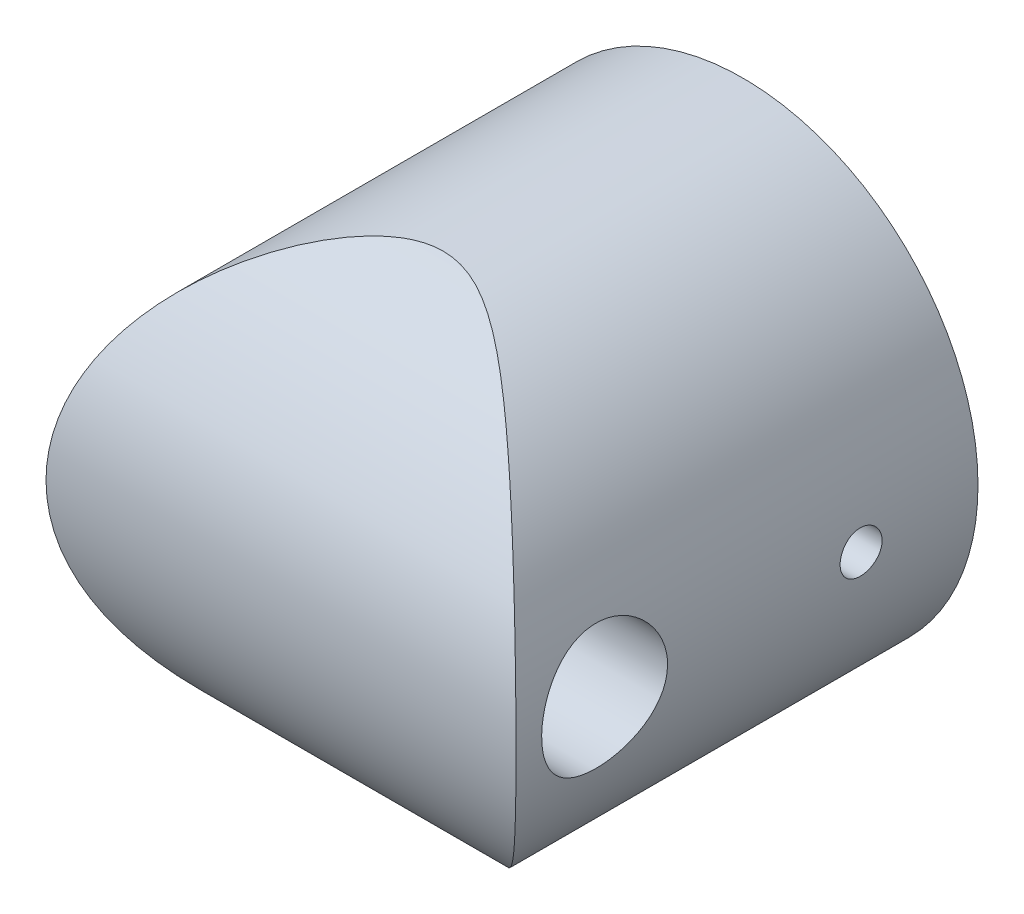
from build123d import *

# Parameters (mm, degrees)
SKETCH1_R                = 19.6
SKETCH1_R_2              = 16.6
BOSS_EXTRUDE1_DEPTH      = 20
SKETCH2_R                = 19.6
BOSS_EXTRUDE2_DEPTH      = 5
BOSS_EXTRUDE4_DEPTH      = 25
BOSS_EXTRUDE4_DEPTH_BACK = 25
SKETCH3_R                = 5.25
SKETCH4_R                = 39.6
SKETCH4_R_2              = 19.6
CUT_EXTRUDE_THIN1_DEPTH  = 25
CUT_EXTRUDE1_DEPTH       = 25
CUT_EXTRUDE1_DEPTH_BACK  = 25
SKETCH6_R                = 1.75


with BuildPart() as part:
    # Sketch1 → Boss-Extrude1 (new body)
    with BuildSketch(Plane(origin=(0, 0, 0), x_dir=(0, 1, 0), z_dir=(0, 0, 1))):
        with Locations(Location((0, 0, 0), (0, 0, 270))):
            Circle(SKETCH1_R)
        with Locations(Location((0, 0, 0), (0, 0, 270))):
            Circle(SKETCH1_R_2, mode=Mode.SUBTRACT)
    extrude(amount=BOSS_EXTRUDE1_DEPTH)

    # Sketch2 → Boss-Extrude2 (add)
    with BuildSketch(Plane.XY.offset(20)):
        Circle(SKETCH2_R)
    extrude(amount=BOSS_EXTRUDE2_DEPTH)

    # Sketch3 → Boss-Extrude4 (add, two sides: drawn at the far end of the back side and taken through both)
    with BuildSketch(Plane.YZ.offset(-BOSS_EXTRUDE4_DEPTH_BACK)):
        with BuildLine():
            Line((19.6, 25), (0, 25))
            Line((0, 25), (-19.6, 25))
            ThreePointArc((-19.6, 25), (0, 38.529292798), (19.6, 25))
        make_face()
        with Locations(Location((0, 31.139297983, 0), (0, 0, 270))):
            Circle(SKETCH3_R, mode=Mode.SUBTRACT)
    extrude(amount=BOSS_EXTRUDE4_DEPTH + BOSS_EXTRUDE4_DEPTH_BACK)

    # Sketch4 → Cut-Extrude-Thin1 (cut)
    with BuildSketch(Plane(origin=(0, 0, 20), x_dir=(1, 0, 0), z_dir=(0, 0, -1))):
        Circle(SKETCH4_R)
        Circle(SKETCH4_R_2, mode=Mode.SUBTRACT)
    extrude(amount=-CUT_EXTRUDE_THIN1_DEPTH, mode=Mode.SUBTRACT)

    # Sketch6 → Cut-Extrude1 (cut, two sides: drawn at the far end of the back side and taken through both)
    with BuildSketch(Plane.YZ.offset(-CUT_EXTRUDE1_DEPTH_BACK)):
        with Locations(Location((0, 9.747221623, 0), (0, 0, 90))):
            Circle(SKETCH6_R)
    extrude(amount=CUT_EXTRUDE1_DEPTH + CUT_EXTRUDE1_DEPTH_BACK, mode=Mode.SUBTRACT)


solid = part.part
